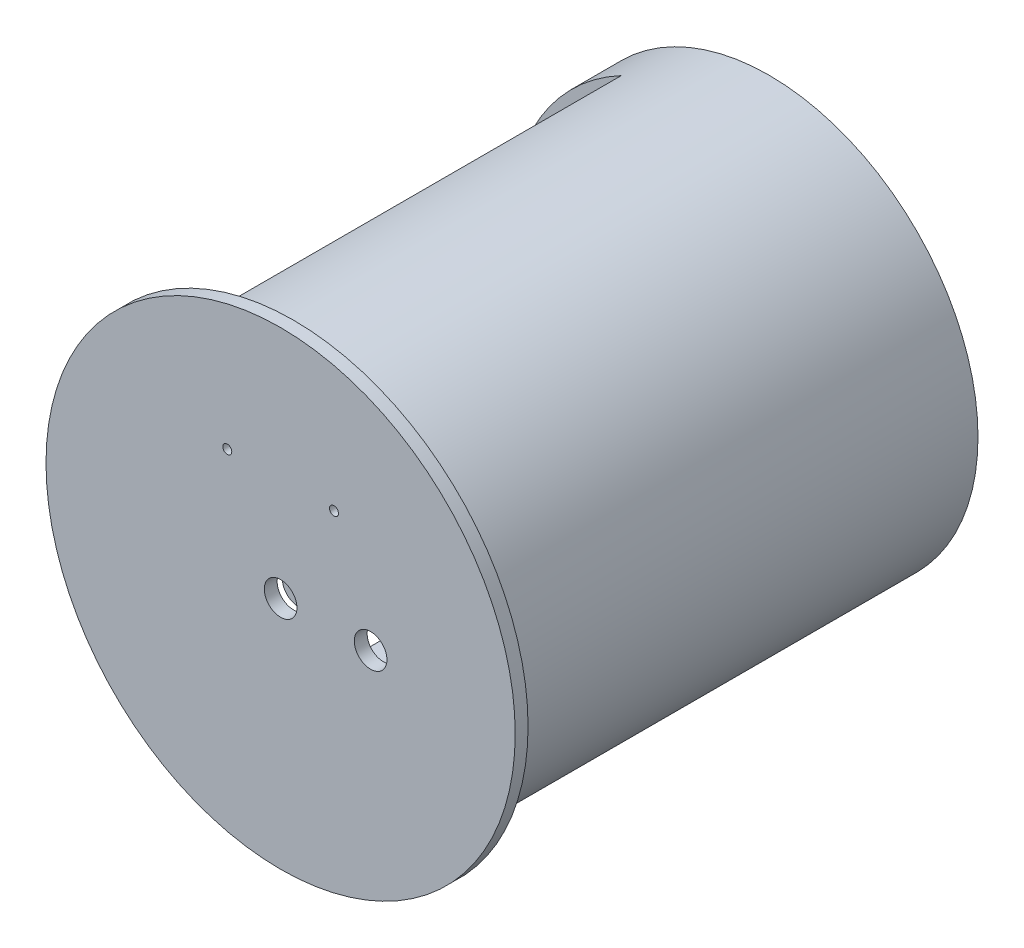
from build123d import *

# Parameters (mm, degrees)
CROQUIS1_R              = 162.5
SALIENTE_EXTRUIR1_DEPTH = 370
CROQUIS2_R              = 132
CORTAR_EXTRUIR1_DEPTH   = 417
CROQUIS3_W              = 307.465117838
CROQUIS3_H              = 287.064574964
CORTAR_EXTRUIR2_DEPTH   = 417
CROQUIS4_R              = 182.5
CROQUIS4_R_2            = 12.7
CROQUIS4_R_3            = 3.5
SALIENTE_EXTRUIR2_DEPTH = 10
SALIENTE_EXTRUIR3_DEPTH = 84
CROQUIS6_R              = 11.039446922
CROQUIS6_R_2            = 15.273211948
CROQUIS6_R_3            = 8.18574154
SALIENTE_EXTRUIR4_DEPTH = 113
CROQUIS7_R              = 12.7
SALIENTE_EXTRUIR5_DEPTH = 351


with BuildPart() as part:
    # Croquis1 → Saliente-Extruir1 (new body)
    with BuildSketch(Plane.XY):
        Circle(CROQUIS1_R)
    extrude(amount=SALIENTE_EXTRUIR1_DEPTH)

    # Croquis2 → Cortar-Extruir1 (cut)
    with BuildSketch(Plane.XY.offset(15)):
        Circle(CROQUIS2_R)
    extrude(amount=CORTAR_EXTRUIR1_DEPTH, mode=Mode.SUBTRACT)

    # Croquis3 → Cortar-Extruir2 (cut)
    with BuildSketch(Plane(origin=(0, 0, 0), x_dir=(0, 0, -1), z_dir=(1, 0, 0))):
        with Locations((-192.5, 0)):
            Rectangle(CROQUIS3_W, CROQUIS3_H)
    extrude(amount=-CORTAR_EXTRUIR2_DEPTH, mode=Mode.SUBTRACT)

    # Croquis4 → Saliente-Extruir2 (add)
    with BuildSketch(Plane.XY.offset(370)):
        Circle(CROQUIS4_R)
        Circle(CROQUIS4_R_2, mode=Mode.SUBTRACT)
        with Locations((70, 0)):
            Circle(CROQUIS4_R_2, mode=Mode.SUBTRACT)
        with Locations((-41.5, 79.772762666)):
            Circle(CROQUIS4_R_3, mode=Mode.SUBTRACT)
        with Locations((41.5, 79.772762666)):
            Circle(CROQUIS4_R_3, mode=Mode.SUBTRACT)
    extrude(amount=SALIENTE_EXTRUIR2_DEPTH)



with BuildPart() as body_2:
    # Croquis5 → Saliente-Extruir3 (new body)
    with BuildSketch(Plane(origin=(0, 0, 0), x_dir=(0, 0, -1), z_dir=(1, 0, 0))):
        with BuildLine():
            Line((-155.328170247, 42.685027874), (-31.585382794, 42.685027874))
            Line((-31.585382794, 42.685027874), (-31.585382794, -42.685027874))
            Line((-31.585382794, -42.685027874), (-155.328170247, -42.685027874))
            ThreePointArc((-155.328170247, -42.685027874), (-183.612441494, -30.969299122), (-195.328170247, -2.685027874))
            Line((-195.328170247, -2.685027874), (-195.328170247, 2.685027874))
            ThreePointArc((-195.328170247, 2.685027874), (-183.612441494, 30.969299122), (-155.328170247, 42.685027874))
        make_face()
    extrude(amount=-SALIENTE_EXTRUIR3_DEPTH)

    # Croquis6 → Saliente-Extruir4 (add)
    with BuildSketch(Plane(origin=(0, 0, 0), x_dir=(0, 0, -1), z_dir=(1, 0, 0))):
        with Locations((-140.988957086, 9.44161276)):
            Circle(CROQUIS6_R)
        with Locations((-110.953177837, -16.572410972)):
            Circle(CROQUIS6_R_2)
        with Locations((-99.615024167, 26.769678135)):
            Circle(CROQUIS6_R_3)
    extrude(amount=-SALIENTE_EXTRUIR4_DEPTH)


with BuildPart() as part_1:
    add(part.part)

    add(body_2.part)  # Saliente-Extruir5 merges body 2
    # Croquis7 → Saliente-Extruir5 (add)
    with BuildSketch(Plane.XY.offset(15)):
        Circle(CROQUIS7_R)
    extrude(amount=SALIENTE_EXTRUIR5_DEPTH)


solid = part_1.part
